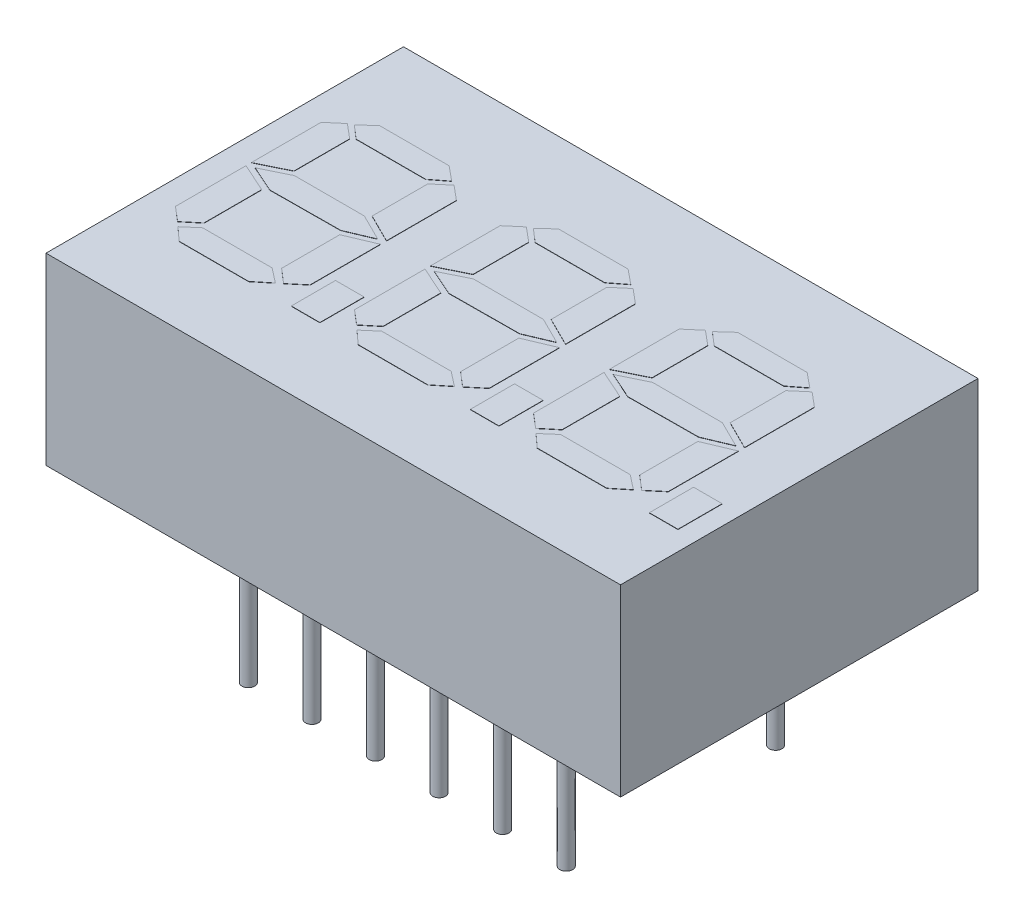
from build123d import *

# Parameters (mm, degrees)
SKETCH_1_W        = 22.5
SKETCH_1_H        = 14
EXTRUDE_1_DEPTH   = 7.2
SKETCH_2_R        = 0.25
EXTRUDE_2_DEPTH   = 6.3
SKETCH_3_W        = 1.121019108
SKETCH_3_H        = 1.732484076
EXTRUDE_1_2_DEPTH = 0.01


with BuildPart() as part:
    # 草图1 → Extrude 1 (new body)
    with BuildSketch(Plane(origin=(0, 0, 0), x_dir=(1, 0, 0), z_dir=(0, 1, 0))):
        Rectangle(SKETCH_1_W, SKETCH_1_H)
    extrude(amount=EXTRUDE_1_DEPTH)

    # 草图2 → 拉伸2 (add)
    with BuildSketch(Plane.XZ):
        with Locations(Location((6.224686657, 4.1, 0), (0, 0, 90))):
            Circle(SKETCH_2_R)
        with Locations(Location((3.734811994, 4.1, 0), (0, 0, 90))):
            Circle(SKETCH_2_R)
        with Locations(Location((1.244937331, 4.1, 0), (0, 0, 90))):
            Circle(SKETCH_2_R)
        with Locations(Location((-1.244937331, 4.1, 0), (0, 0, 90))):
            Circle(SKETCH_2_R)
        with Locations(Location((-3.734811994, 4.1, 0), (0, 0, 90))):
            Circle(SKETCH_2_R)
        with Locations(Location((-6.224686657, 4.1, 0), (0, 0, 90))):
            Circle(SKETCH_2_R)
        with Locations(Location((-6.224686657, -4.1, 0), (0, 0, 90))):
            Circle(SKETCH_2_R)
        with Locations(Location((-3.734811994, -4.1, 0), (0, 0, 90))):
            Circle(SKETCH_2_R)
        with Locations(Location((-1.244937331, -4.1, 0), (0, 0, 90))):
            Circle(SKETCH_2_R)
        with Locations(Location((1.244937331, -4.1, 0), (0, 0, 90))):
            Circle(SKETCH_2_R)
        with Locations(Location((3.734811994, -4.1, 0), (0, 0, 90))):
            Circle(SKETCH_2_R)
        with Locations(Location((6.224686657, -4.1, 0), (0, 0, 90))):
            Circle(SKETCH_2_R)
    extrude(amount=EXTRUDE_2_DEPTH)

    # 草图3 → Extrude 1 2 (add)
    with BuildSketch(Plane(origin=(0, 7.2, 0), x_dir=(1, 0, 0), z_dir=(0, 1, 0))):
        Polygon((-4.991082803, 0.076433121), (-6.112101911, 0.633757962), (-6.112101911, 2.813694268), (-5.556369427, 3.286624204), (-4.991082803, 2.813694268), align=None)
        Polygon((-5.737898089, 3.377388535), (-6.311146497, 2.929936306), (-9.034076433, 2.929936306), (-9.553184713, 3.377388535), (-9.034076433, 3.847133758), (-6.311146497, 3.847133758), align=None)
        Polygon((-4.991082803, -2.910828025), (-5.556369427, -3.388535032), (-6.112101911, -2.910828025), (-6.112101911, -0.632165605), (-4.991082803, -0.159235669), align=None)
        Polygon((-5.223566879, -0.035031847), (-6.242675159, -0.464968153), (-9.002229299, -0.484076433), (-10.038853503, -0.020700637), (-9.008598726, 0.484076433), (-6.268152866, 0.484076433), align=None)
        Polygon((-9.169426752, 0.633757962), (-10.29044586, 0.082802548), (-10.29044586, 2.813694268), (-9.734713376, 3.286624204), (-9.169426752, 2.813694268), align=None)
        Polygon((-9.169426752, -2.888535032), (-9.734713376, -3.361464968), (-10.29044586, -2.888535032), (-10.29044586, -0.127388535), (-9.169426752, -0.632165605), align=None)
        Polygon((-5.737898089, -3.530254777), (-6.311146497, -4), (-9.034076433, -4), (-9.553184713, -3.530254777), (-9.034076433, -3.082802548), (-6.311146497, -3.082802548), align=None)
        with Locations((-4.084076433, -3.133757962)):
            Rectangle(SKETCH_3_W, SKETCH_3_H)
        Polygon((2.020382166, 0.076433121), (0.899363057, 0.633757962), (0.899363057, 2.813694268), (1.455095541, 3.286624204), (2.020382166, 2.813694268), align=None)
        Polygon((1.273566879, 3.377388535), (0.700318471, 2.929936306), (-2.022611465, 2.929936306), (-2.541719745, 3.377388535), (-2.022611465, 3.847133758), (0.700318471, 3.847133758), align=None)
        Polygon((2.020382166, -2.910828025), (1.455095541, -3.388535032), (0.899363057, -2.910828025), (0.899363057, -0.632165605), (2.020382166, -0.159235669), align=None)
        Polygon((1.787898089, -0.035031847), (0.768789809, -0.464968153), (-1.990764331, -0.484076433), (-3.027388535, -0.020700637), (-1.997133758, 0.484076433), (0.743312102, 0.484076433), align=None)
        Polygon((-2.157961783, 0.633757962), (-3.278980892, 0.082802548), (-3.278980892, 2.813694268), (-2.723248408, 3.286624204), (-2.157961783, 2.813694268), align=None)
        Polygon((-2.157961783, -2.888535032), (-2.723248408, -3.361464968), (-3.278980892, -2.888535032), (-3.278980892, -0.127388535), (-2.157961783, -0.632165605), align=None)
        Polygon((1.273566879, -3.530254777), (0.700318471, -4), (-2.022611465, -4), (-2.541719745, -3.530254777), (-2.022611465, -3.082802548), (0.700318471, -3.082802548), align=None)
        with Locations((2.927388535, -3.133757962)):
            Rectangle(SKETCH_3_W, SKETCH_3_H)
        Polygon((9.031847134, 0.076433121), (7.910828025, 0.633757962), (7.910828025, 2.813694268), (8.46656051, 3.286624204), (9.031847134, 2.813694268), align=None)
        Polygon((8.285031847, 3.377388535), (7.711783439, 2.929936306), (4.988853503, 2.929936306), (4.469745223, 3.377388535), (4.988853503, 3.847133758), (7.711783439, 3.847133758), align=None)
        Polygon((9.031847134, -2.910828025), (8.46656051, -3.388535032), (7.910828025, -2.910828025), (7.910828025, -0.632165605), (9.031847134, -0.159235669), align=None)
        Polygon((8.799363057, -0.035031847), (7.780254777, -0.464968153), (5.020700637, -0.484076433), (3.984076433, -0.020700637), (5.01433121, 0.484076433), (7.75477707, 0.484076433), align=None)
        Polygon((4.853503185, 0.633757962), (3.732484076, 0.082802548), (3.732484076, 2.813694268), (4.288216561, 3.286624204), (4.853503185, 2.813694268), align=None)
        Polygon((4.853503185, -2.888535032), (4.288216561, -3.361464968), (3.732484076, -2.888535032), (3.732484076, -0.127388535), (4.853503185, -0.632165605), align=None)
        Polygon((8.285031847, -3.530254777), (7.711783439, -4), (4.988853503, -4), (4.469745223, -3.530254777), (4.988853503, -3.082802548), (7.711783439, -3.082802548), align=None)
        with Locations((9.938853503, -3.133757962)):
            Rectangle(SKETCH_3_W, SKETCH_3_H)
    extrude(amount=EXTRUDE_1_2_DEPTH)


solid = part.part
